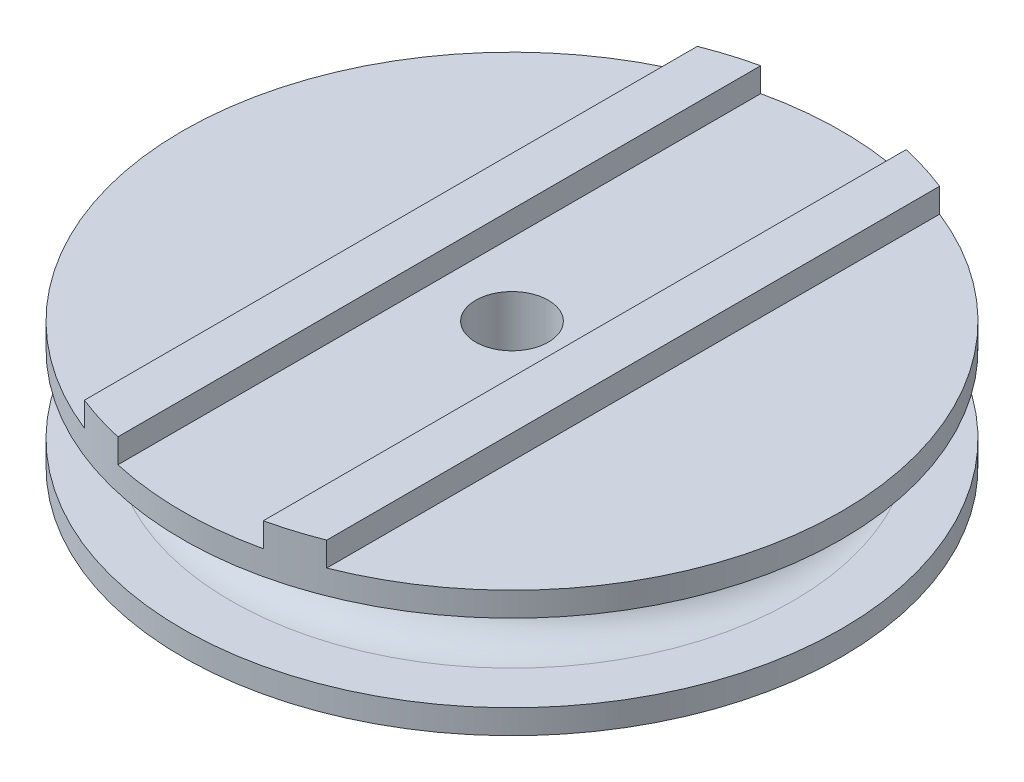
from build123d import *

# Parameters (mm, degrees)
SKETCH_2_R          = 1.5
CUT_EXTRUDE_1_DEPTH = 20.923855049
EXTRUDE_START       = 1
EXTRUDE_1_DEPTH     = 1


with BuildPart() as part:
    # ｽｹｯﾁ1 → 回転1 (revolve)
    with BuildSketch(Plane.XY):
        with BuildLine():
            Line((0, 0), (13.6, 0))
            Line((13.6, 0), (13.6, 1))
            Line((13.6, 1), (11.6, 1))
            ThreePointArc((11.6, 1), (10, 2.6), (11.6, 4.2))
            Line((11.6, 4.2), (13.6, 4.2))
            Line((13.6, 4.2), (13.6, 5.2))
            Line((13.6, 5.2), (0, 5.2))
            Line((0, 5.2), (0, 0))
        make_face()
    revolve(axis=Axis((0, 0, 0), (0, 1, 0)))

    # ｽｹｯﾁ2 → ｶｯﾄ - 押し出し1 (cut, through all)
    with BuildSketch(Plane(origin=(0, 5.2, 0), x_dir=(1, 0, 0), z_dir=(0, 1, 0))):
        with Locations(Location((0, 0, 0), (0, 0, 180))):
            Circle(SKETCH_2_R)
    extrude(amount=-CUT_EXTRUDE_1_DEPTH, mode=Mode.SUBTRACT)

    # ｽｹｯﾁ3 → ﾎﾞｽ - 押し出し1 (add)
    with BuildSketch(Plane(origin=(0, 5.2, 0), x_dir=(1, 0, 0), z_dir=(0, 1, 0)).offset(EXTRUDE_START)):
        with BuildLine():
            Line((3, 13.264991519), (3, -13.264991519))
            ThreePointArc((3, -13.264991519), (4.011896667, -12.99479454), (5, -12.647529403))
            Line((5, -12.647529403), (5, 12.647529403))
            ThreePointArc((5, 12.647529403), (4.011896667, 12.99479454), (3, 13.264991519))
        make_face()
        with BuildLine():
            Line((-5, 12.647529403), (-5, -12.647529403))
            ThreePointArc((-5, -12.647529403), (-4.011896667, -12.99479454), (-3, -13.264991519))
            Line((-3, -13.264991519), (-3, 13.264991519))
            ThreePointArc((-3, 13.264991519), (-4.011896667, 12.99479454), (-5, 12.647529403))
        make_face()
    extrude(amount=-EXTRUDE_1_DEPTH)


solid = part.part
